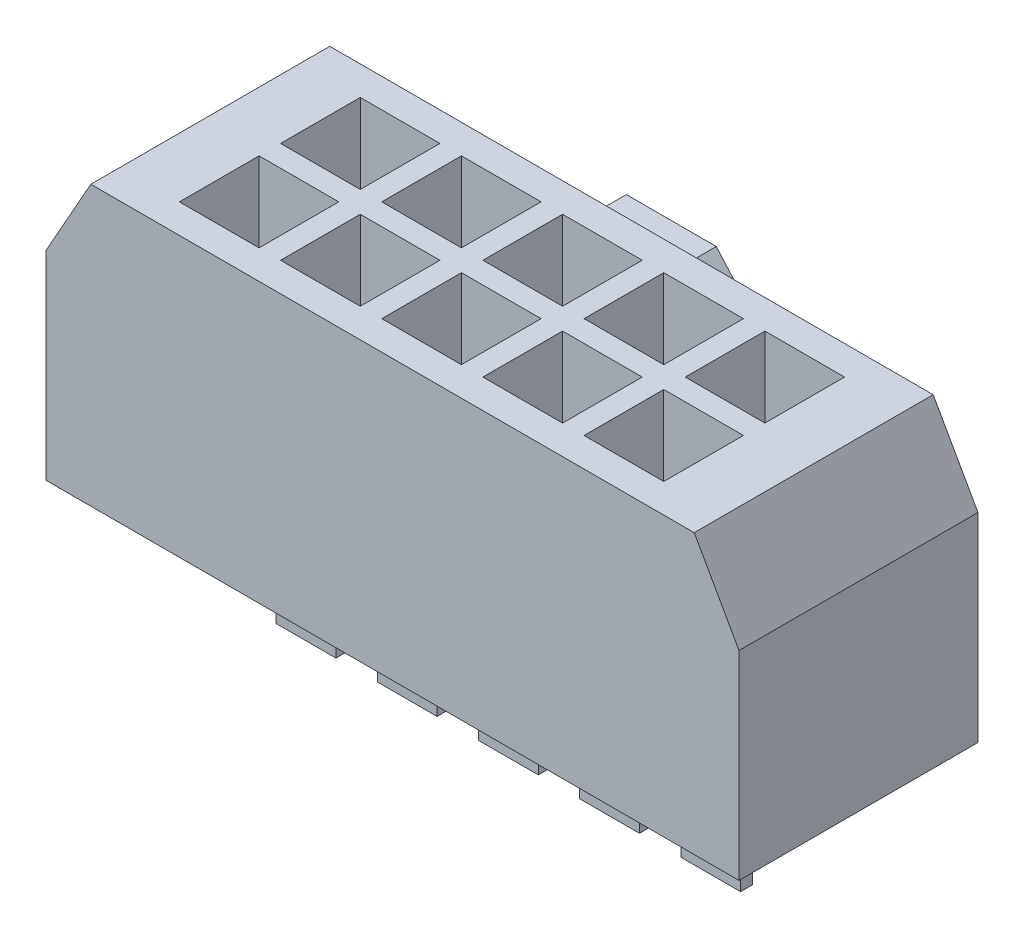
from build123d import *

# Parameters (mm, degrees)
EXTRUDE_1_DEPTH     = 3
EXTRUDE_START       = -4
EXTRUDE_2_DEPTH     = 1
SKETCH_2_W          = 2
SKETCH_2_H          = 2
CUT_EXTRUDE_1_DEPTH = 3
SKETCH_3_W          = 1.5
SKETCH_3_H          = 0.3
EXTRUDE_3_DEPTH     = 2.5


with BuildPart() as part:
    # Эскиз1 → Бобышка-Вытянуть1 (new, symmetric)
    with BuildSketch(Plane.XY):
        Polygon((-8.7, 1.5), (-8.7, -3.5), (-1.9, -3.5), (-1.9, 2.122094745), (-1.129392625, 2.998992793), (1.129392625, 2.998992793), (1.9, 2.122094745), (1.9, -3.5), (8.7, -3.5), (8.7, 1.5), (7.575, 3.5), (-7.575, 3.5), align=None)
        Polygon((-1.9, 2.122094745), (-1.9, -3.5), (1.9, -3.5), (1.9, 2.122094745), (1.129392625, 2.998992793), (-1.129392625, 2.998992793), align=None)
    extrude(amount=EXTRUDE_1_DEPTH, both=True)

    # Эскиз1<3> → Бобышка-Вытянуть2 (add)
    with BuildSketch(Plane.XY.offset(EXTRUDE_START)):
        Polygon((-1.9, 2.122094745), (-1.9, -3.5), (1.9, -3.5), (1.9, 2.122094745), (1.129392625, 2.998992793), (-1.129392625, 2.998992793), align=None)
    extrude(amount=EXTRUDE_2_DEPTH)

    # Эскиз2 → Вырез-Вытянуть1 (cut)
    with BuildSketch(Plane(origin=(0, 3.5, 0), x_dir=(1, 0, 0), z_dir=(0, 1, 0))):
        with Locations((0, 1.27)):
            Rectangle(SKETCH_2_W, SKETCH_2_H)
        with Locations((0, -1.27)):
            Rectangle(SKETCH_2_W, SKETCH_2_H)
        with Locations((2.54, 1.27)):
            Rectangle(SKETCH_2_W, SKETCH_2_H)
        with Locations((2.54, -1.27)):
            Rectangle(SKETCH_2_W, SKETCH_2_H)
        with Locations((-2.54, 1.27)):
            Rectangle(SKETCH_2_W, SKETCH_2_H)
        with Locations((-2.54, -1.27)):
            Rectangle(SKETCH_2_W, SKETCH_2_H)
        with Locations((-5.08, 1.27)):
            Rectangle(SKETCH_2_W, SKETCH_2_H)
        with Locations((-5.08, -1.27)):
            Rectangle(SKETCH_2_W, SKETCH_2_H)
        with Locations((5.08, 1.27)):
            Rectangle(SKETCH_2_W, SKETCH_2_H)
        with Locations((5.08, -1.27)):
            Rectangle(SKETCH_2_W, SKETCH_2_H)
    extrude(amount=-CUT_EXTRUDE_1_DEPTH, mode=Mode.SUBTRACT)

    # Эскиз3 → Бобышка-Вытянуть3 (add)
    with BuildSketch(Plane.XZ.offset(3.5)):
        with Locations((-3.175, -0.575)):
            Rectangle(SKETCH_3_W, SKETCH_3_H)
        with Locations((-1.905, 0.575)):
            Rectangle(SKETCH_3_W, SKETCH_3_H)
        with Locations((-0.635, -0.575)):
            Rectangle(SKETCH_3_W, SKETCH_3_H)
        with Locations((0.635, 0.575)):
            Rectangle(SKETCH_3_W, SKETCH_3_H)
        with Locations((1.905, -0.575)):
            Rectangle(SKETCH_3_W, SKETCH_3_H)
        with Locations((3.175, 0.575)):
            Rectangle(SKETCH_3_W, SKETCH_3_H)
        with Locations((-4.445, 0.575)):
            Rectangle(SKETCH_3_W, SKETCH_3_H)
        with Locations((-5.715, -0.575)):
            Rectangle(SKETCH_3_W, SKETCH_3_H)
        with Locations((5.715, 0.575)):
            Rectangle(SKETCH_3_W, SKETCH_3_H)
        with Locations((4.445, -0.575)):
            Rectangle(SKETCH_3_W, SKETCH_3_H)
    extrude(amount=EXTRUDE_3_DEPTH)


solid = part.part
